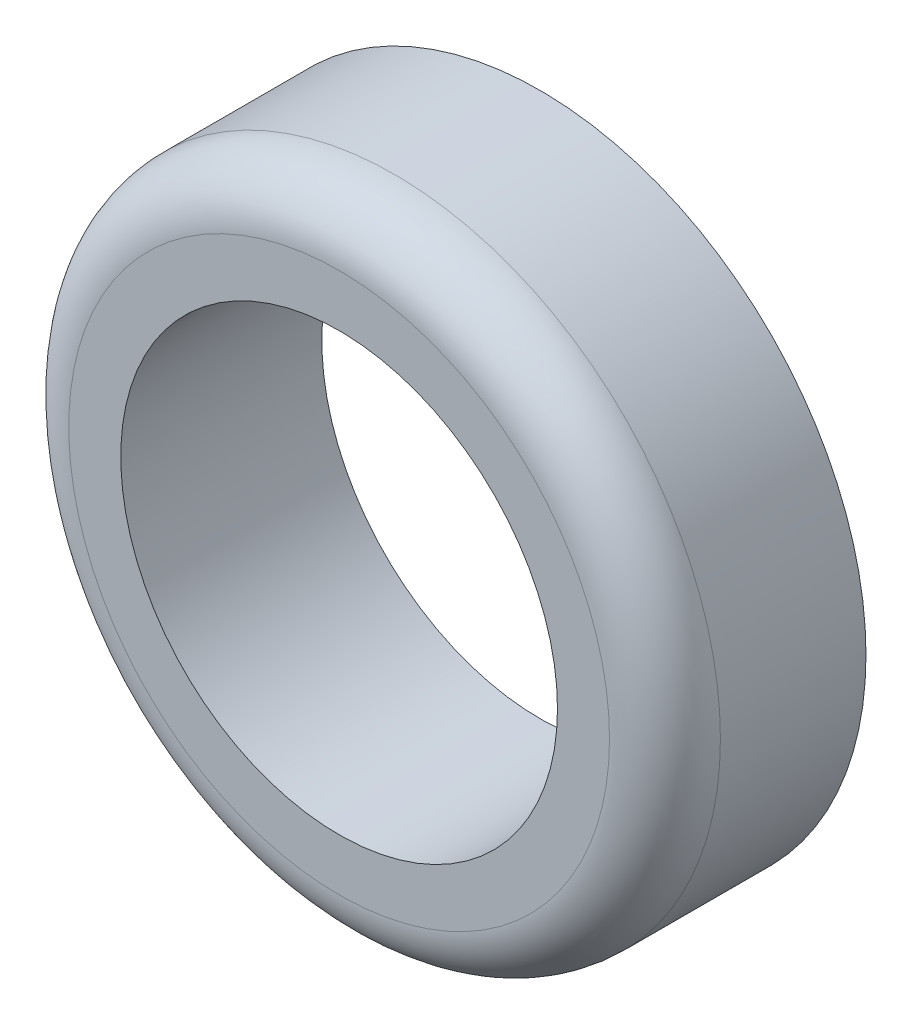
from build123d import *

# Parameters (mm, degrees)
SKETCH1_R           = 47.005
SKETCH1_R_2         = 31.5
BOSS_EXTRUDE1_DEPTH = 29
FILLET1_R           = 8


with BuildPart() as part:
    # Sketch1 → Boss-Extrude1 (new body)
    with BuildSketch(Plane.XY):
        Circle(SKETCH1_R)
        Circle(SKETCH1_R_2, mode=Mode.SUBTRACT)
    extrude(amount=BOSS_EXTRUDE1_DEPTH)

    # Fillet1
    fillet1_edges = [part.edges().sort_by_distance(p)[0] for p in [
        (-47.005, 0, 29),
    ]]
    fillet(fillet1_edges, radius=FILLET1_R)


solid = part.part
